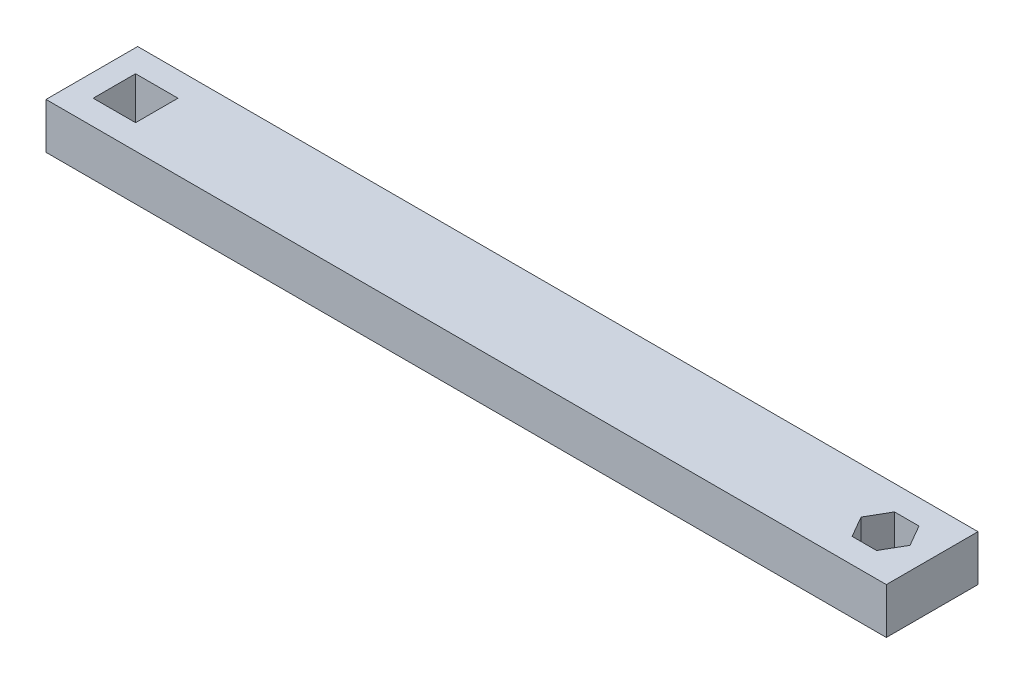
from build123d import *

# Parameters (mm, degrees)
SZKIC1_W                    = 110
SZKIC1_H                    = 12
DODANIE_WYCI_GNI_CIE1_DEPTH = 6
SZKIC2_W                    = 5.55
SZKIC2_H                    = 5.55
WYTNIJ_WYCI_GNI_CIE1_DEPTH  = 6
WYTNIJ_WYCI_GNI_CIE2_DEPTH  = 6


with BuildPart() as part:
    # Szkic1 → Dodanie-wyciągnięcie1 (new body)
    with BuildSketch(Plane(origin=(0, 0, 0), x_dir=(1, 0, 0), z_dir=(0, 1, 0))):
        with Locations((55, -90.241330813)):
            Rectangle(SZKIC1_W, SZKIC1_H)
    extrude(amount=DODANIE_WYCI_GNI_CIE1_DEPTH)

    # Szkic2 → Wytnij-wyciągnięcie1 (cut)
    with BuildSketch(Plane(origin=(0, 6, 0), x_dir=(1, 0, 0), z_dir=(0, 1, 0))):
        with Locations((5.725, -90.241330813)):
            Rectangle(SZKIC2_W, SZKIC2_H)
    extrude(amount=-WYTNIJ_WYCI_GNI_CIE1_DEPTH, mode=Mode.SUBTRACT)

    # Szkic3 → Wytnij-wyciągnięcie2 (cut)
    with BuildSketch(Plane(origin=(0, 6, 0), x_dir=(1, 0, 0), z_dir=(0, 1, 0))):
        Polygon((102.295706006, -93.016330813), (105.5, -93.016330813), (107.102146997, -90.241330813), (105.5, -87.466330813), (102.295706006, -87.466330813), (100.693559009, -90.241330813), align=None)
    extrude(amount=-WYTNIJ_WYCI_GNI_CIE2_DEPTH, mode=Mode.SUBTRACT)


solid = part.part
